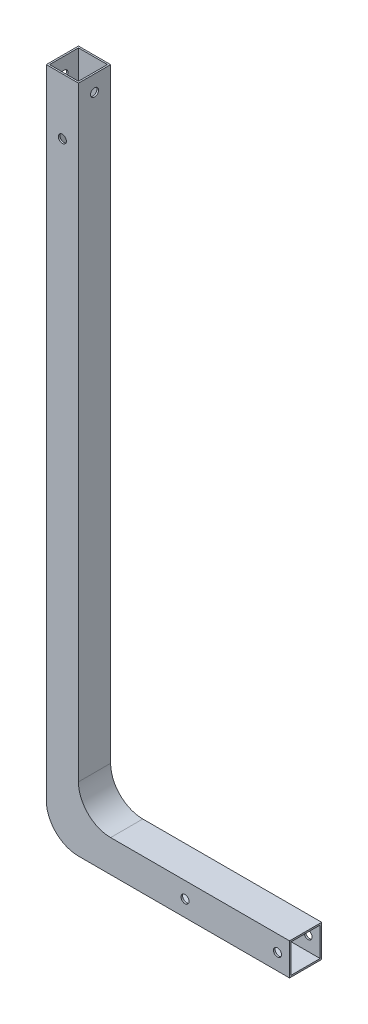
from build123d import *

# Parameters (mm, degrees)
BOSS_EXTRUDE1_DEPTH       = 50.8
SHELL1_T                  = -2.54
SKETCH2_W                 = 45.72
SKETCH2_H                 = 45.72
CUT_EXTRUDE2_DEPTH        = 50.8
F_97_0_5_DIAMETER_HOLE1_D = 12.7
F_97_0_5_DIAMETER_HOLE2_D = 12.7
F_97_0_5_DIAMETER_HOLE3_D = 12.7


with BuildPart() as part:
    # Sketch1 → Boss-Extrude1 (new body)
    with BuildSketch(Plane.XY):
        with BuildLine():
            Line((0, 1057.275), (0, 50.8))
            ThreePointArc((0, 50.8), (14.878975516, 14.878975516), (50.8, 0))
            Line((50.8, 0), (384.175, 0))
            Line((384.175, 0), (384.175, 50.8))
            Line((384.175, 50.8), (101.6, 50.8))
            ThreePointArc((101.6, 50.8), (65.678975516, 65.678975516), (50.8, 101.6))
            Line((50.8, 101.6), (50.8, 1057.275))
            Line((50.8, 1057.275), (0, 1057.275))
        make_face()
    extrude(amount=BOSS_EXTRUDE1_DEPTH)

    # Shell1
    shell1_openings = [part.faces().sort_by_distance(p)[0] for p in [
        (25.4, 1057.275, 25.4),
    ]]
    offset(amount=SHELL1_T, openings=shell1_openings, kind=Kind.INTERSECTION)

    # Sketch2 → Cut-Extrude2 (cut)
    with BuildSketch(Plane(origin=(384.175, 0, 0), x_dir=(0, 0, -1), z_dir=(1, 0, 0))):
        with Locations((-25.4, 25.4)):
            Rectangle(SKETCH2_W, SKETCH2_H)
    extrude(amount=-CUT_EXTRUDE2_DEPTH, mode=Mode.SUBTRACT)

    # #97 (0.5) Diameter Hole1 (through all)
    with Locations(Plane(origin=(365.125, 25.4, 50.8), x_dir=(1, 0, 0), z_dir=(0, 0, 1))):
        with Locations((0, 0), (-146.05, 0)):
            Hole(F_97_0_5_DIAMETER_HOLE1_D / 2)

    # #97 (0.5) Diameter Hole2 (through all)
    with Locations(Plane(origin=(0, 1031.875, 25.4), x_dir=(0, 0, -1), z_dir=(-1, 0, 0))):
        with Locations((0, 0)):
            Hole(F_97_0_5_DIAMETER_HOLE2_D / 2)

    # #97 (0.5) Diameter Hole3 (through all)
    with Locations(Plane(origin=(25.4, 968.375, 50.8), x_dir=(1, 0, 0), z_dir=(0, 0, 1))):
        with Locations((0, 0)):
            Hole(F_97_0_5_DIAMETER_HOLE3_D / 2)


solid = part.part
